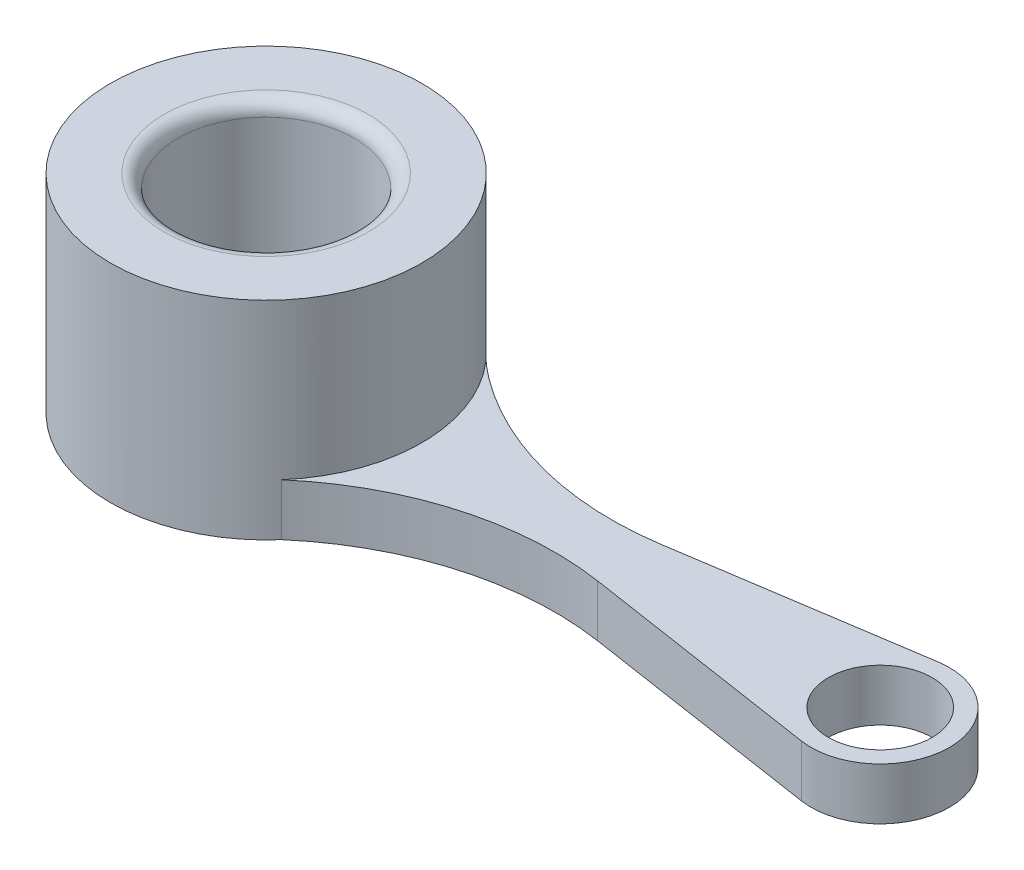
from build123d import *

# Parameters (mm, degrees)
SKETCH2_W               = 25
SKETCH2_H               = 9
BOSS_EXTRUDE3_DEPTH     = 6
SKETCH3_R               = 2.55
CUT_EXTRUDE1_DEPTH      = 5
CUT_EXTRUDE2_DEPTH      = 28.239676944
CUT_EXTRUDE2_DEPTH_BACK = 28.239676944
SKETCH4_R               = 1.5
SKETCH5_R               = 1.5
CUT_EXTRUDE3_DEPTH      = 4.5
CUT_EXTRUDE4_DEPTH      = 28.239676944
FILLET2_R               = 0.4
SKETCH8_R               = 1
CUT_EXTRUDE5_DEPTH      = 28.239676944
CUT_EXTRUDE7_DEPTH      = 10


with BuildPart() as part:
    # Sketch2 → Boss-Extrude3 (new body)
    with BuildSketch(Plane(origin=(0, 0, 0), x_dir=(1, 0, 0), z_dir=(0, 1, 0))):
        with Locations((12.5, 4.5)):
            Rectangle(SKETCH2_W, SKETCH2_H)
    extrude(amount=BOSS_EXTRUDE3_DEPTH)

    # Sketch3 → Cut-Extrude1 (cut)
    with BuildSketch(Plane(origin=(0, 6, 0), x_dir=(1, 0, 0), z_dir=(0, 1, 0))):
        with Locations(Location((4.5, 4.5, 0), (0, 0, 270))):
            Circle(SKETCH3_R)
    extrude(amount=-CUT_EXTRUDE1_DEPTH, mode=Mode.SUBTRACT)

    # Sketch4 → Cut-Extrude2 (cut, two sides: drawn at the far end of the back side and taken through both)
    with BuildSketch(Plane(origin=(0, 6, 0), x_dir=(1, 0, 0), z_dir=(0, 1, 0)).offset(-CUT_EXTRUDE2_DEPTH_BACK)):
        with Locations(Location((22.25, 4.5, 0), (0, 0, 270))):
            Circle(SKETCH4_R)
    extrude(amount=CUT_EXTRUDE2_DEPTH + CUT_EXTRUDE2_DEPTH_BACK, mode=Mode.SUBTRACT)

    # Sketch5 → Cut-Extrude3 (cut)
    with BuildSketch(Plane(origin=(0, 6, 0), x_dir=(1, 0, 0), z_dir=(0, 1, 0))):
        with BuildLine():
            Line((25, 9), (4.5, 9))
            ThreePointArc((4.5, 9), (7.681980515, 7.681980515), (9, 4.5))
            ThreePointArc((9, 4.5), (7.681980515, 1.318019485), (4.5, 0))
            Line((4.5, 0), (25, 0))
            Line((25, 0), (25, 9))
        make_face()
        with Locations(Location((22.25, 4.5, 0), (0, 0, 270))):
            Circle(SKETCH5_R, mode=Mode.SUBTRACT)
    extrude(amount=-CUT_EXTRUDE3_DEPTH, mode=Mode.SUBTRACT)

    # Sketch6 → Cut-Extrude4 (cut, through all)
    with BuildSketch(Plane(origin=(0, 6, 0), x_dir=(1, 0, 0), z_dir=(0, 1, 0))):
        with BuildLine():
            ThreePointArc((0, 4.5), (1.318019485, 7.681980515), (4.5, 9))
            Line((4.5, 9), (0, 9))
            Line((0, 9), (0, 4.5))
        make_face()
        with BuildLine():
            ThreePointArc((4.5, 0), (1.318019485, 1.318019485), (0, 4.5))
            Line((0, 4.5), (0, 0))
            Line((0, 0), (4.5, 0))
        make_face()
    extrude(amount=-CUT_EXTRUDE4_DEPTH, mode=Mode.SUBTRACT)

    # Fillet2
    fillet2_edges = [part.edges().sort_by_distance(p)[0] for p in [
        (4.5, 6, -7.05),
    ]]
    fillet(fillet2_edges, radius=FILLET2_R)

    # Sketch8 → Cut-Extrude5 (cut, through all)
    with BuildSketch(Plane.XZ):
        with Locations(Location((4.5, -4.5, 0), (0, 0, 270))):
            Circle(SKETCH8_R)
    extrude(amount=-CUT_EXTRUDE5_DEPTH, mode=Mode.SUBTRACT)

    # Sketch9 → Cut-Extrude7 (cut)
    with BuildSketch(Plane(origin=(0, 1.5, 0), x_dir=(1, 0, 0), z_dir=(0, 1, 0))):
        with BuildLine():
            Line((25, 9), (4.5, 9))
            ThreePointArc((4.5, 9), (6.368244423, 8.593856712), (7.899255542, 7.448739011))
            ThreePointArc((7.899255542, 7.448739011), (11.227526502, 5.656546092), (15, 5.416157335))
            Line((15, 5.416157335), (21.94811323, 6.477084818))
            ThreePointArc((21.94811323, 6.477084818), (24.25, 4.499999978), (21.948113186, 2.522915189))
            Line((21.948113186, 2.522915189), (15, 3.583842665))
            ThreePointArc((15, 3.583842665), (11.227526502, 3.343453908), (7.899255542, 1.551260989))
            ThreePointArc((7.899255542, 1.551260989), (6.368244423, 0.406143288), (4.5, 0))
            Line((4.5, 0), (25, 0))
            Line((25, 0), (25, 9))
        make_face()
    extrude(amount=-CUT_EXTRUDE7_DEPTH, mode=Mode.SUBTRACT)


solid = part.part
